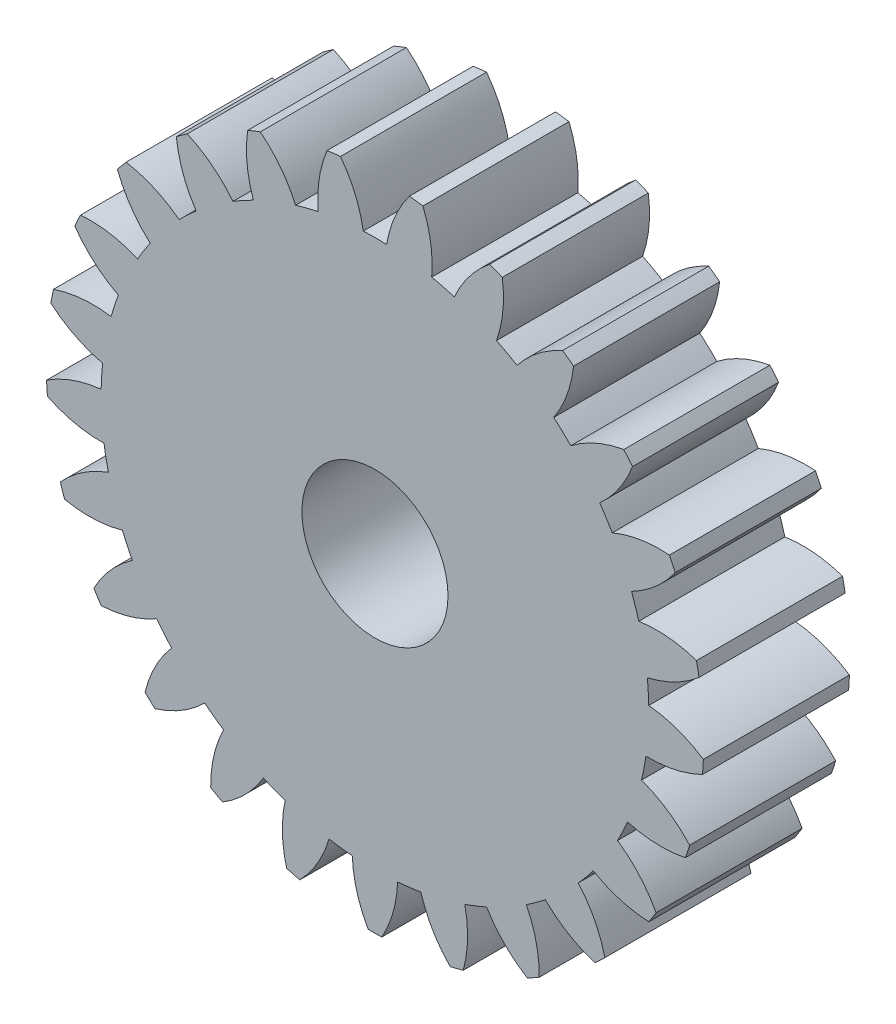
from build123d import *

# Parameters (mm, degrees)
SKETCH_1_R      = 1.5
EXTRUDE_1_DEPTH = 3


with BuildPart() as part:
    # 草图1 → 凸台-拉伸1 (new body)
    with BuildSketch(Plane.XY):
        with BuildLine():
            ThreePointArc((-6.655206862, 1.127262893), (-6.156247128, 0.795666927), (-5.592723466, 0.592300797))
            ThreePointArc((-5.592723466, 0.592300797), (-5.612902321, 0.353133882), (-5.622858145, 0.113323788))
            ThreePointArc((-5.622858145, 0.113323788), (-6.207426789, -0.017810496), (-6.744012071, -0.284255492))
            ThreePointArc((-6.744012071, -0.284255492), (-6.736680417, -0.423836007), (-6.726460182, -0.563234787))
            ThreePointArc((-6.726460182, -0.563234787), (-6.160711622, -0.760326816), (-5.564316992, -0.81716119))
            ThreePointArc((-5.564316992, -0.81716119), (-5.524383498, -1.053832513), (-5.474388197, -1.288584444))
            ThreePointArc((-5.474388197, -1.288584444), (-6.007979772, -1.560975215), (-6.461445064, -1.952492684))
            ThreePointArc((-6.461445064, -1.952492684), (-6.419631485, -2.085864712), (-6.37506527, -2.218342354))
            ThreePointArc((-6.37506527, -2.218342354), (-5.778075948, -2.26854643), (-5.186284018, -2.175277933))
            ThreePointArc((-5.186284018, -2.175277933), (-5.088747343, -2.394582736), (-4.981942305, -2.609526178))
            ThreePointArc((-4.981942305, -2.609526178), (-5.431029289, -3.006058119), (-5.772881701, -3.49804758))
            ThreePointArc((-5.772881701, -3.49804758), (-5.699213497, -3.616830866), (-5.623101562, -3.734063313))
            ThreePointArc((-5.623101562, -3.734063313), (-5.032382511, -3.634224927), (-4.482377745, -3.396713964))
            ThreePointArc((-4.482377745, -3.396713964), (-4.333366477, -3.584872518), (-4.176462656, -3.766501784))
            ThreePointArc((-4.176462656, -3.766501784), (-4.512827263, -4.262259337), (-4.721586948, -4.823807282))
            ThreePointArc((-4.721586948, -4.823807282), (-4.620692965, -4.920538235), (-4.517817702, -5.01515934))
            ThreePointArc((-4.517817702, -5.01515934), (-3.970485973, -4.771551707), (-3.496827193, -4.404721964))
            ThreePointArc((-3.496827193, -4.404721964), (-3.305704259, -4.549911576), (-3.108560498, -4.686814231))
            ThreePointArc((-3.108560498, -4.686814231), (-3.311067702, -5.250647125), (-3.373617523, -5.846469431))
            ThreePointArc((-3.373617523, -5.846469431), (-3.2518373, -5.91507009), (-3.128662741, -5.981134462))
            ThreePointArc((-3.128662741, -5.981134462), (-2.6591092, -5.609064345), (-2.291558128, -5.135965084))
            ThreePointArc((-2.291558128, -5.135965084), (-2.070332484, -5.229062957), (-1.845336051, -5.312636903))
            ThreePointArc((-1.845336051, -5.312636903), (-1.901261581, -5.909117443), (-1.813671302, -6.501776404))
            ThreePointArc((-1.813671302, -6.501776404), (-1.678656738, -6.537936338), (-1.542922393, -6.571292908))
            ThreePointArc((-1.542922393, -6.571292908), (-1.180650815, -6.094138841), (-0.942302038, -5.544496629))
            ThreePointArc((-0.942302038, -5.544496629), (-0.704874106, -5.57965308), (-0.466162354, -5.604647059))
            ThreePointArc((-0.466162354, -5.604647059), (-0.371992202, -6.196296181), (-0.139765443, -6.748552854))
            ThreePointArc((-0.139765443, -6.748552854), (0, -6.75), (0.139765443, -6.748552854))
            ThreePointArc((0.139765443, -6.748552854), (0.371992202, -6.196296181), (0.466162354, -5.604647059))
            ThreePointArc((0.466162354, -5.604647059), (0.704874106, -5.57965308), (0.942302038, -5.544496629))
            ThreePointArc((0.942302038, -5.544496629), (1.180650815, -6.094138841), (1.542922393, -6.571292908))
            ThreePointArc((1.542922393, -6.571292908), (1.678656738, -6.537936338), (1.813671302, -6.501776404))
            ThreePointArc((1.813671302, -6.501776404), (1.901261581, -5.909117443), (1.845336051, -5.312636903))
            ThreePointArc((1.845336051, -5.312636903), (2.070332484, -5.229062957), (2.291558128, -5.135965084))
            ThreePointArc((2.291558128, -5.135965084), (2.6591092, -5.609064345), (3.128662741, -5.981134462))
            ThreePointArc((3.128662741, -5.981134462), (3.2518373, -5.91507009), (3.373617523, -5.846469431))
            ThreePointArc((3.373617523, -5.846469431), (3.311067702, -5.250647125), (3.108560498, -4.686814231))
            ThreePointArc((3.108560498, -4.686814231), (3.305704259, -4.549911576), (3.496827193, -4.404721964))
            ThreePointArc((3.496827193, -4.404721964), (3.970485973, -4.771551707), (4.517817702, -5.01515934))
            ThreePointArc((4.517817702, -5.01515934), (4.620692965, -4.920538235), (4.721586948, -4.823807282))
            ThreePointArc((4.721586948, -4.823807282), (4.512827263, -4.262259337), (4.176462656, -3.766501784))
            ThreePointArc((4.176462656, -3.766501784), (4.333366477, -3.584872518), (4.482377745, -3.396713964))
            ThreePointArc((4.482377745, -3.396713964), (5.032382511, -3.634224927), (5.623101562, -3.734063313))
            ThreePointArc((5.623101562, -3.734063313), (5.699213497, -3.616830866), (5.772881701, -3.49804758))
            ThreePointArc((5.772881701, -3.49804758), (5.431029289, -3.006058119), (4.981942305, -2.609526178))
            ThreePointArc((4.981942305, -2.609526178), (5.088747343, -2.394582736), (5.186284018, -2.175277933))
            ThreePointArc((5.186284018, -2.175277933), (5.778075948, -2.26854643), (6.37506527, -2.218342354))
            ThreePointArc((6.37506527, -2.218342354), (6.419631485, -2.085864712), (6.461445064, -1.952492684))
            ThreePointArc((6.461445064, -1.952492684), (6.007979772, -1.560975215), (5.474388197, -1.288584444))
            ThreePointArc((5.474388197, -1.288584444), (5.524383498, -1.053832513), (5.564316992, -0.81716119))
            ThreePointArc((5.564316992, -0.81716119), (6.160711622, -0.760326816), (6.726460182, -0.563234787))
            ThreePointArc((6.726460182, -0.563234787), (6.736680417, -0.423836007), (6.744012071, -0.284255492))
            ThreePointArc((6.744012071, -0.284255492), (6.207426789, -0.017810496), (5.622858145, 0.113323788))
            ThreePointArc((5.622858145, 0.113323788), (5.612902321, 0.353133882), (5.592723466, 0.592300797))
            ThreePointArc((5.592723466, 0.592300797), (6.156247128, 0.795666927), (6.655206862, 1.127262893))
            ThreePointArc((6.655206862, 1.127262893), (6.630438942, 1.264823873), (6.602827997, 1.401842518))
            ThreePointArc((6.602827997, 1.401842518), (6.016838352, 1.526473321), (5.418023237, 1.508111471))
            ThreePointArc((5.418023237, 1.508111471), (5.348741848, 1.737911576), (5.269718556, 1.964546346))
            ThreePointArc((5.269718556, 1.964546346), (5.764962986, 2.301665991), (6.165782418, 2.7469305))
            ThreePointArc((6.165782418, 2.7469305), (6.107582604, 2.874010218), (6.046763956, 2.999857607))
            ThreePointArc((6.046763956, 2.999857607), (5.448189833, 2.974843206), (4.872754002, 2.808138963))
            ThreePointArc((4.872754002, 2.808138963), (4.748500253, 3.013489895), (4.615597848, 3.213352223))
            ThreePointArc((4.615597848, 3.213352223), (5.011445017, 3.663042916), (5.28893919, 4.193998361))
            ThreePointArc((5.28893919, 4.193998361), (5.200964389, 4.302611931), (5.110759497, 4.40938061))
            ThreePointArc((5.110759497, 4.40938061), (4.53721151, 4.236292751), (4.021311713, 3.931720757))
            ThreePointArc((4.021311713, 3.931720757), (3.849892924, 4.099719561), (3.671462152, 4.260251362))
            ThreePointArc((3.671462152, 4.260251362), (3.943039527, 4.794257382), (4.07977246, 5.37754188))
            ThreePointArc((4.07977246, 5.37754188), (3.967550453, 5.460864712), (3.853627223, 5.541846012))
            ThreePointArc((3.853627223, 5.541846012), (3.341143501, 5.231560443), (2.917195619, 4.808258075))
            ThreePointArc((2.917195619, 4.808258075), (2.709382663, 4.928348769), (2.496634987, 5.039463239))
            ThreePointArc((2.496634987, 5.039463239), (2.626878362, 5.624231026), (2.614258623, 6.223194666))
            ThreePointArc((2.614258623, 6.223194666), (2.484840731, 6.27599128), (2.354357378, 6.326096848))
            ThreePointArc((2.354357378, 6.326096848), (1.935139158, 5.898109951), (1.629781396, 5.382674856))
            ThreePointArc((1.629781396, 5.382674856), (1.398631925, 5.447311698), (1.164935063, 5.502027108))
            ThreePointArc((1.164935063, 5.502027108), (1.145660769, 6.100813549), (0.984481302, 6.677821244))
            ThreePointArc((0.984481302, 6.677821244), (0.845999327, 6.696774234), (0.7071546, 6.712855754))
            ThreePointArc((0.7071546, 6.712855754), (0.407542904, 6.19405952), (0.239962014, 5.618878378))
            ThreePointArc((0.239962014, 5.618878378), (0, 5.624), (-0.239962014, 5.618878378))
            ThreePointArc((-0.239962014, 5.618878378), (-0.407542904, 6.19405952), (-0.7071546, 6.712855754))
            ThreePointArc((-0.7071546, 6.712855754), (-0.845999327, 6.696774234), (-0.984481302, 6.677821244))
            ThreePointArc((-0.984481302, 6.677821244), (-1.145660769, 6.100813549), (-1.164935063, 5.502027108))
            ThreePointArc((-1.164935063, 5.502027108), (-1.398631925, 5.447311698), (-1.629781396, 5.382674855))
            ThreePointArc((-1.629781396, 5.382674855), (-1.935139158, 5.898109951), (-2.354357378, 6.326096848))
            ThreePointArc((-2.354357378, 6.326096848), (-2.484840731, 6.27599128), (-2.614258623, 6.223194666))
            ThreePointArc((-2.614258623, 6.223194666), (-2.626878362, 5.624231026), (-2.496634987, 5.039463239))
            ThreePointArc((-2.496634987, 5.039463239), (-2.709382663, 4.928348769), (-2.917195619, 4.808258075))
            ThreePointArc((-2.917195619, 4.808258075), (-3.341143501, 5.231560443), (-3.853627223, 5.541846012))
            ThreePointArc((-3.853627223, 5.541846012), (-3.967550453, 5.460864712), (-4.07977246, 5.37754188))
            ThreePointArc((-4.07977246, 5.37754188), (-3.943039527, 4.794257382), (-3.671462152, 4.260251362))
            ThreePointArc((-3.671462152, 4.260251362), (-3.849892924, 4.099719561), (-4.021311713, 3.931720757))
            ThreePointArc((-4.021311713, 3.931720757), (-4.53721151, 4.236292751), (-5.110759497, 4.40938061))
            ThreePointArc((-5.110759497, 4.40938061), (-5.200964389, 4.302611931), (-5.28893919, 4.193998361))
            ThreePointArc((-5.28893919, 4.193998361), (-5.011445017, 3.663042916), (-4.615597848, 3.213352223))
            ThreePointArc((-4.615597848, 3.213352223), (-4.748500253, 3.013489895), (-4.872754002, 2.808138963))
            ThreePointArc((-4.872754002, 2.808138963), (-5.448189833, 2.974843206), (-6.046763956, 2.999857607))
            ThreePointArc((-6.046763956, 2.999857607), (-6.107582604, 2.874010218), (-6.165782418, 2.7469305))
            ThreePointArc((-6.165782418, 2.7469305), (-5.764962986, 2.301665991), (-5.269718556, 1.964546346))
            ThreePointArc((-5.269718556, 1.964546346), (-5.348741848, 1.737911576), (-5.418023237, 1.508111471))
            ThreePointArc((-5.418023237, 1.508111471), (-6.016838352, 1.526473321), (-6.602827997, 1.401842518))
            ThreePointArc((-6.602827997, 1.401842518), (-6.630438942, 1.264823873), (-6.655206862, 1.127262893))
        make_face()
        Circle(SKETCH_1_R, mode=Mode.SUBTRACT)
    extrude(amount=EXTRUDE_1_DEPTH)


solid = part.part
